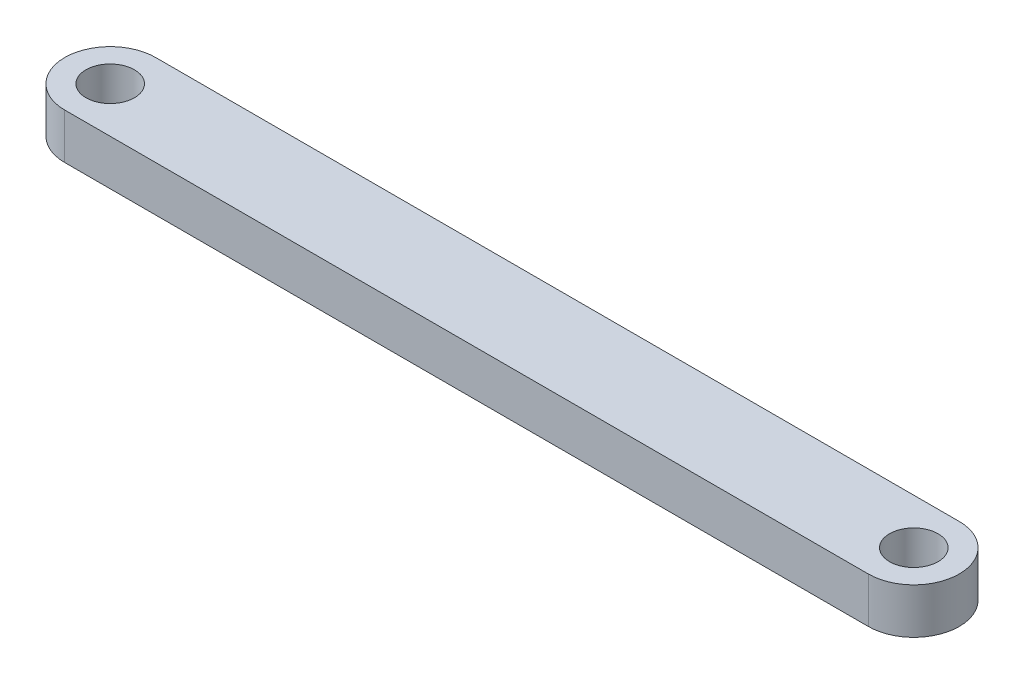
from build123d import *

# Parameters (mm, degrees)
SKETCH1_R           = 1.6
BOSS_EXTRUDE1_DEPTH = 3


with BuildPart() as part:
    # Sketch1 → Boss-Extrude1 (new body)
    with BuildSketch(Plane(origin=(0, 0, 0), x_dir=(1, 0, 0), z_dir=(0, 1, 0))):
        with BuildLine():
            Line((0, 3), (53, 3))
            ThreePointArc((53, 3), (56, 0), (53, -3))
            Line((53, -3), (0, -3))
            ThreePointArc((0, -3), (-3, 0), (0, 3))
        make_face()
        with Locations(Location((0, 0, 0), (0, 0, 270))):
            Circle(SKETCH1_R, mode=Mode.SUBTRACT)
        with Locations(Location((53, 0, 0), (0, 0, 270))):
            Circle(SKETCH1_R, mode=Mode.SUBTRACT)
    extrude(amount=BOSS_EXTRUDE1_DEPTH)


solid = part.part
